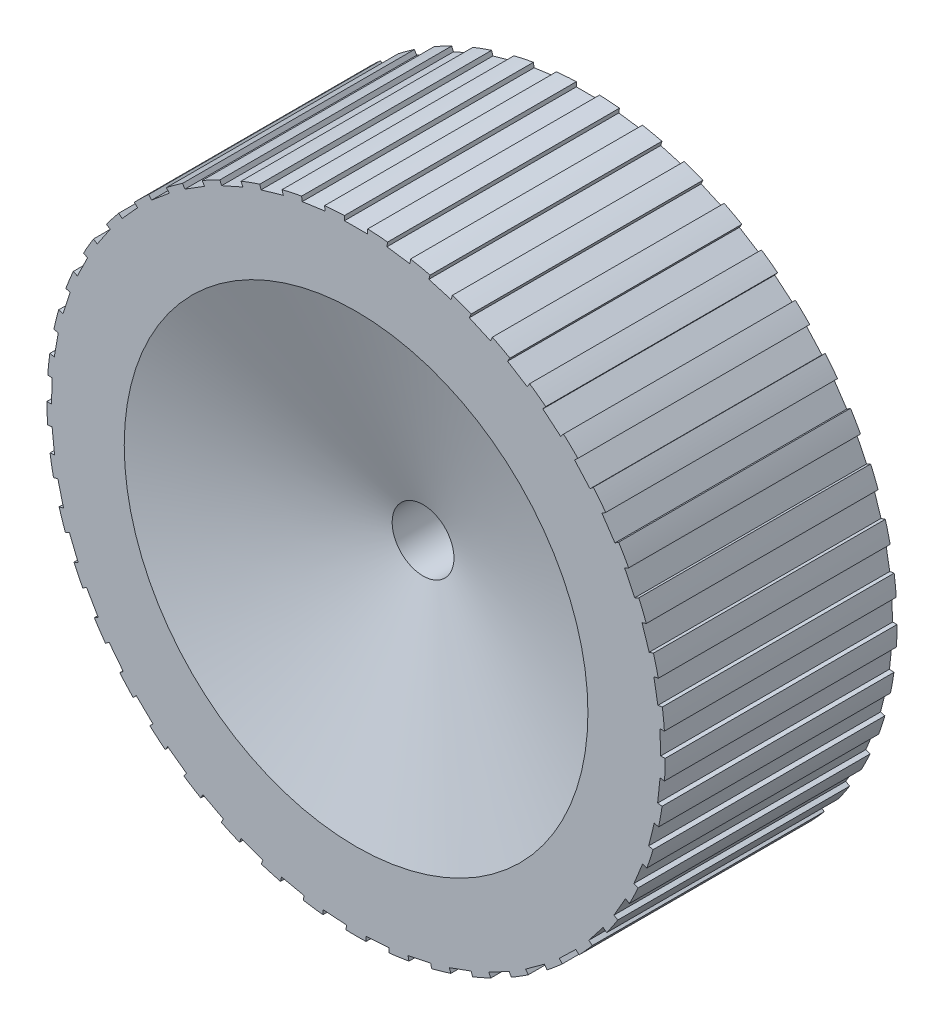
from build123d import *

# Parameters (mm, degrees)
SKETCH1_R           = 40
SKETCH1_R_2         = 4
BOSS_EXTRUDE1_DEPTH = 30
SKETCH4_W           = 3
SKETCH4_H           = 1.220203242
CUT_EXTRUDE1_DEPTH  = 65.031242374


with BuildPart() as part:
    # Sketch1 → Boss-Extrude1 (new body)
    with BuildSketch(Plane.XY):
        Circle(SKETCH1_R)
        Circle(SKETCH1_R_2, mode=Mode.SUBTRACT)
    extrude(amount=BOSS_EXTRUDE1_DEPTH)

    # Sketch3 → Cut-Revolve1 (revolve, cut)
    with BuildSketch(Plane(origin=(0, 0, 0), x_dir=(0, 0, -1), z_dir=(1, 0, 0))):
        Polygon((0, 30), (-10, 0), (2.605153632, 0), (2.605153632, 27.394846368), align=None)
        Polygon((-32.605153632, 0), (-20, 0), (-30, 30), (-32.605153632, 27.394846368), align=None)
    revolve(axis=Axis((0, 0, -2.605153632), (0, 0, 1)), mode=Mode.SUBTRACT)

    # Sketch4 → Cut-Extrude1 (cut, through all)
    with BuildSketch(Plane.XY.offset(30)):
        Polygon((7.137235876, 40.006127252), (6.967416407, 38.797798944), (3.996612201, 39.215318247), (4.16643167, 40.423646555), align=None)
        with Locations((0, 40)):
            Rectangle(SKETCH4_W, SKETCH4_H)
        Polygon((12.635553574, 38.623479123), (12.299219979, 37.450544485), (9.415434891, 38.277456552), (9.751768486, 39.45039119), align=None)
        Polygon((17.887934595, 36.489068906), (17.391633224, 35.374357776), (14.650996851, 36.594567706), (15.147298222, 37.709278835), align=None)
        Polygon((22.792147316, 33.644440468), (22.145538111, 32.609649432), (19.601393823, 34.199407224), (20.248003027, 35.234198261), align=None)
        Polygon((27.252736815, 30.144961267), (26.468405289, 29.210231354), (24.17027196, 31.138594183), (24.954603485, 32.073324096), align=None)
        Polygon((31.182882791, 26.058744684), (30.276095066, 25.242269349), (28.268703247, 27.471703825), (29.175490972, 28.28817916), align=None)
        Polygon((34.506089424, 21.465324277), (33.49449509, 20.782995283), (31.81691638, 23.270108001), (32.828510714, 23.952436995), align=None)
        Polygon((37.157674277, 16.454105749), (36.060962868, 15.919203855), (34.745849427, 18.615585994), (35.842560836, 19.150487888), align=None)
        Polygon((39.086027266, 11.12262677), (37.925545021, 10.745563231), (36.998494038, 13.59873278), (38.158976283, 13.975796319), align=None)
        Polygon((40.253615194, 5.574658512), (39.05194958, 5.362772442), (38.531005047, 8.317195702), (39.732670661, 8.529081771), align=None)
        Polygon((40.637712289, -0.081814133), (39.418252362, -0.124398612), (39.313553872, 2.873773869), (40.533013799, 2.916358348), align=None)
        Polygon((40.23084254, -5.736694359), (39.017323699, -5.609148389), (39.330909089, -2.625582703), (40.54442793, -2.753128673), align=None)
        Polygon((39.040925203, -11.279916354), (37.856967212, -10.984722473), (38.582732899, -8.073835294), (39.76669089, -8.369029175), align=None)
        Polygon((37.091120665, -16.603587608), (35.95976792, -16.146491429), (37.0835877, -13.364939865), (38.214940446, -13.822036045), align=None)
        Polygon((34.419379654, -21.604088916), (33.362652649, -20.993987295), (34.862652649, -18.395911084), (35.919379654, -19.006012705), align=None)
        Polygon((31.07770457, -26.184091208), (30.116171293, -25.432859079), (31.963155719, -23.068826818), (32.924688995, -23.820058947), align=None)
        Polygon((27.131137316, -30.254449948), (26.28351292, -29.376709191), (28.441532321, -27.29273408), (29.289156717, -28.170474836), align=None)
        Polygon((22.656493335, -33.735940233), (21.939275865, -32.748775074), (24.366326848, -30.985419317), (25.083544319, -31.972584476), align=None)
        Polygon((17.740866484, -36.560798816), (17.168015761, -35.483423301), (19.816858539, -34.075008612), (20.389709262, -35.152384128), align=None)
        Polygon((12.479933846, -38.674043038), (12.062599758, -37.527427055), (14.88167762, -36.501366625), (15.299011708, -37.647982608), align=None)
        Polygon((6.976093491, -40.034541002), (6.722398972, -38.841002129), (9.656841774, -38.217267056), (9.910536293, -39.41080593), align=None)
        Polygon((1.336471412, -40.615812165), (1.251354337, -39.398581277), (4.244046487, -39.189311856), (4.329163563, -40.406542744), align=None)
        Polygon((-4.329163563, -40.406542744), (-4.244046487, -39.189311856), (-1.251354337, -39.398581277), (-1.336471412, -40.615812165), align=None)
        Polygon((-9.910536293, -39.41080593), (-9.656841774, -38.217267056), (-6.722398972, -38.841002129), (-6.976093491, -40.034541002), align=None)
        Polygon((-15.299011708, -37.647982608), (-14.88167762, -36.501366625), (-12.062599758, -37.527427055), (-12.479933846, -38.674043038), align=None)
        Polygon((-20.389709262, -35.152384128), (-19.816858539, -34.075008612), (-17.168015761, -35.483423301), (-17.740866484, -36.560798816), align=None)
        Polygon((-25.083544318, -31.972584476), (-24.366326848, -30.985419317), (-21.939275865, -32.748775074), (-22.656493335, -33.735940233), align=None)
        Polygon((-29.289156717, -28.170474836), (-28.441532321, -27.29273408), (-26.28351292, -29.376709191), (-27.131137316, -30.254449948), align=None)
        Polygon((-32.924688995, -23.820058947), (-31.963155719, -23.068826819), (-30.116171293, -25.432859079), (-31.077704569, -26.184091208), align=None)
        Polygon((-35.919379654, -19.006012705), (-34.862652649, -18.395911084), (-33.362652649, -20.993987295), (-34.419379654, -21.604088916), align=None)
        Polygon((-38.214940445, -13.822036045), (-37.0835877, -13.364939865), (-35.95976792, -16.146491429), (-37.091120665, -16.603587608), align=None)
        Polygon((-39.76669089, -8.369029175), (-38.582732899, -8.073835294), (-37.856967212, -10.984722473), (-39.040925203, -11.279916354), align=None)
        Polygon((-40.54442793, -2.753128673), (-39.330909089, -2.625582703), (-39.017323699, -5.609148389), (-40.23084254, -5.736694359), align=None)
        Polygon((-40.533013799, 2.916358348), (-39.313553872, 2.873773869), (-39.418252362, -0.124398612), (-40.637712289, -0.081814133), align=None)
        Polygon((-39.732670661, 8.529081771), (-38.531005047, 8.317195701), (-39.05194958, 5.362772442), (-40.253615194, 5.574658512), align=None)
        Polygon((-38.158976283, 13.975796319), (-36.998494038, 13.59873278), (-37.925545021, 10.745563231), (-39.086027266, 11.12262677), align=None)
        Polygon((-35.842560836, 19.150487888), (-34.745849427, 18.615585994), (-36.060962867, 15.919203855), (-37.157674277, 16.454105749), align=None)
        Polygon((-32.828510714, 23.952436995), (-31.81691638, 23.270108001), (-33.49449509, 20.782995283), (-34.506089424, 21.465324277), align=None)
        Polygon((-29.175490972, 28.28817916), (-28.268703247, 27.471703825), (-30.276095066, 25.242269348), (-31.182882791, 26.058744684), align=None)
        Polygon((-24.954603485, 32.073324096), (-24.17027196, 31.138594183), (-26.468405289, 29.210231354), (-27.252736815, 30.144961267), align=None)
        Polygon((-20.248003027, 35.234198261), (-19.601393823, 34.199407224), (-22.145538111, 32.609649432), (-22.792147316, 33.644440468), align=None)
        Polygon((-15.147298222, 37.709278835), (-14.650996851, 36.594567706), (-17.391633224, 35.374357776), (-17.887934595, 36.489068906), align=None)
        Polygon((-9.751768486, 39.45039119), (-9.415434891, 38.277456552), (-12.299219979, 37.450544485), (-12.635553574, 38.623479123), align=None)
        Polygon((-4.16643167, 40.423646555), (-3.996612201, 39.215318247), (-6.967416407, 38.797798944), (-7.137235876, 40.006127252), align=None)
    extrude(amount=-CUT_EXTRUDE1_DEPTH, mode=Mode.SUBTRACT)


solid = part.part
